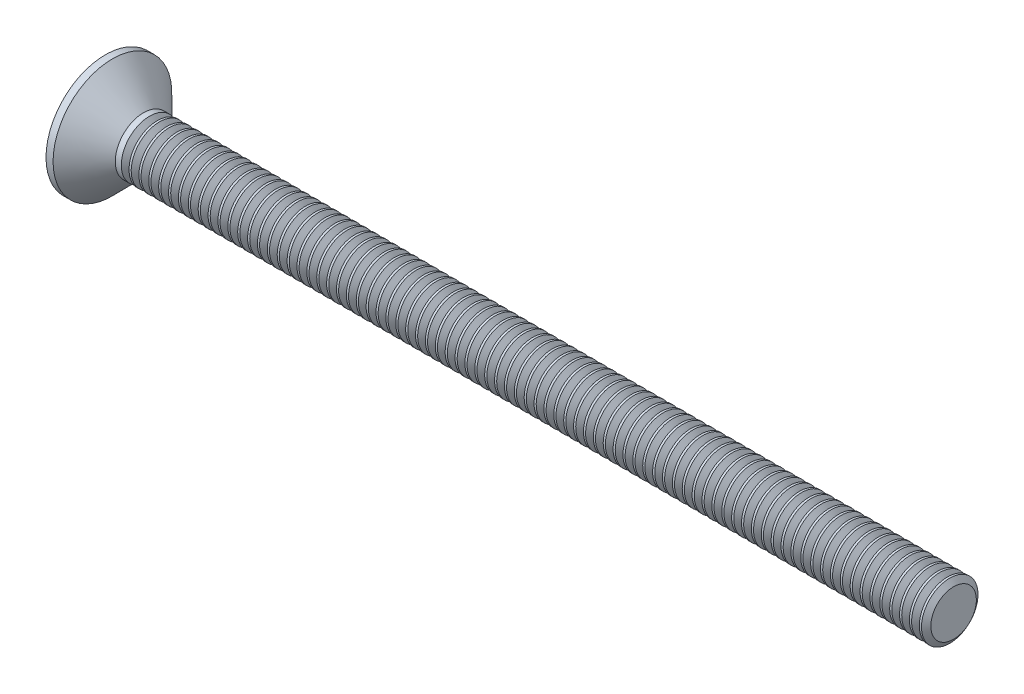
from build123d import *

# Parameters (mm, degrees)
CIRPATTERN1_COUNT = 2
CIRPATTERN1_ANGLE = 90
THDSCHPAT_COUNT   = 82
THDSCHPAT_PITCH   = 0.698765432


with BuildPart() as part:
    # BodySke → Base-Revolve (revolve)
    with BuildSketch(Plane.XY, mode=Mode.PRIVATE) as base_revolve_sk:
        Polygon((0, 0), (0, 4.2), (0.5, 4.2), (2.7, 2), (60, 2), (60, 0), align=None)
    revolve(base_revolve_sk.sketch.rotate(Axis((-6.35, 0, 0), (1, 0, 0)), 90), axis=Axis((-6.35, 0, 0), (1, 0, 0)))

    # Sketch3 → Cross section 0
    with BuildSketch(Plane.ZY):
        with BuildLine():
            Line((-0.48, 2.23), (0.48, 2.23))
            Line((0.48, 2.23), (0.48, -2.23))
            Line((0.48, -2.23), (-0.48, -2.23))
            Line((-0.48, -2.23), (-0.48, 2.23))
        make_face()
    # Sketch4 → Cross section 1
    with BuildSketch(Plane.ZY.offset(-2.65)):
        with BuildLine():
            Line((-0.24, 0.24), (0.24, 0.24))
            Line((0.24, 0.24), (0.24, -0.24))
            Line((0.24, -0.24), (-0.24, -0.24))
            Line((-0.24, -0.24), (-0.24, 0.24))
        make_face()
    cross = loft(mode=Mode.SUBTRACT)

    # CirPattern1: Cross ×2 about axis
    cirpattern1_axis = Axis((0, 0, 0), (1, 0, 0))
    for i in range(1, CIRPATTERN1_COUNT):
        add(cross.rotate(cirpattern1_axis, i * CIRPATTERN1_ANGLE / (CIRPATTERN1_COUNT - 1)), mode=Mode.SUBTRACT)

    # ThdSchSke → ThreadSchematic (revolve, cut)
    with BuildSketch(Plane.XY):
        Polygon((3.400001, -1.61), (3.12692006, -2), (3.12692006, -2.5), (3.67308194, -2.5), (3.67308194, -2), align=None)
    threadschematic = revolve(axis=Axis((-3.175, 0, 0), (1, 0, 0)), mode=Mode.SUBTRACT)

    # ThdSchPat: ThreadSchematic ×82
    with Locations(*[(i * THDSCHPAT_PITCH, 0, 0) for i in range(1, THDSCHPAT_COUNT)]):
        add(threadschematic, mode=Mode.SUBTRACT)


solid = part.part
